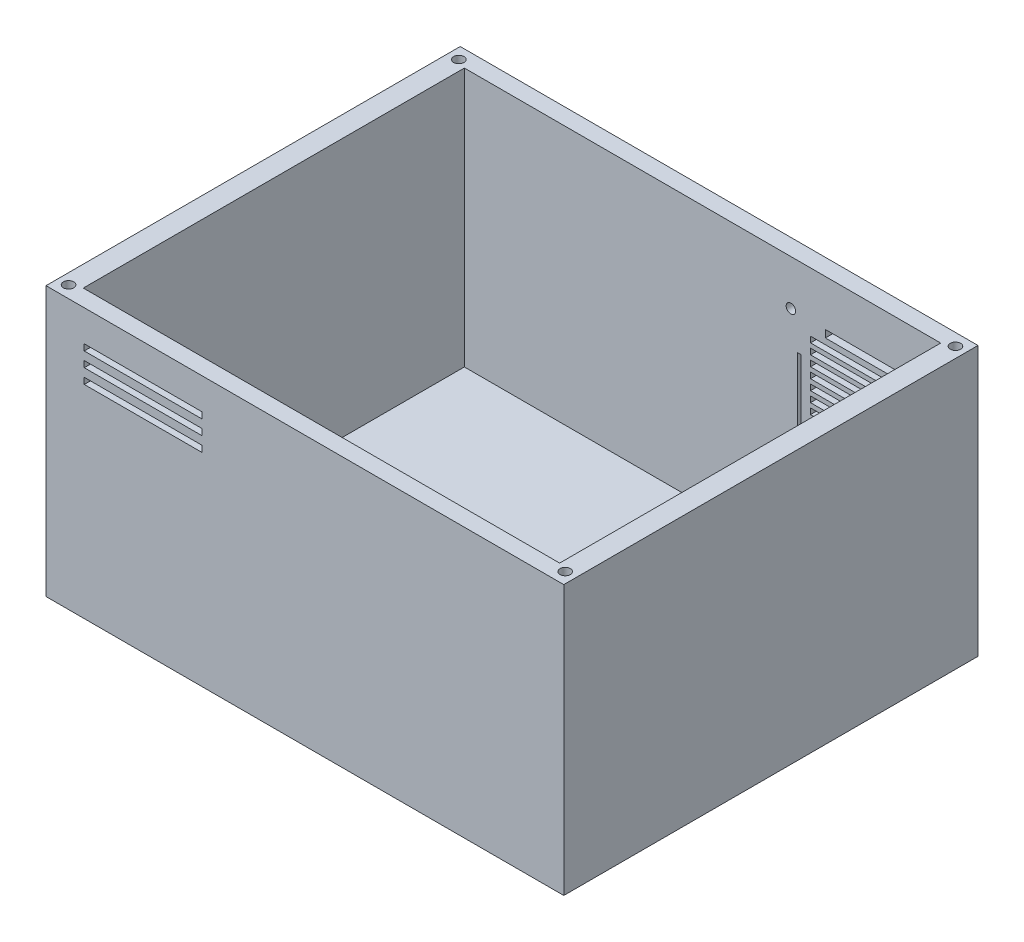
from build123d import *

# Parameters (mm, degrees)
SKETCH1_W           = 250
SKETCH1_H           = 200
SKETCH1_W_2         = 230
SKETCH1_H_2         = 184
BOSS_EXTRUDE1_DEPTH = 125
SKETCH2_W           = 250
SKETCH2_H           = 200
BOSS_EXTRUDE2_DEPTH = 5
SKETCH3_R           = 2.5
CUT_EXTRUDE1_DEPTH  = 5
SKETCH4_W           = 56.888032222
SKETCH4_H           = 3
CUT_EXTRUDE2_DEPTH  = 10
SKETCH5_R           = 2.28
CUT_EXTRUDE3_DEPTH  = 10
SKETCH6_W           = 51.923491606
SKETCH6_H           = 2.813206455
SKETCH6_W_2         = 1.706106107
SKETCH6_H_2         = 39.950466237
SKETCH6_W_3         = 35.31144106
SKETCH6_H_3         = 3.552801372
CUT_EXTRUDE4_DEPTH  = 10


with BuildPart() as part:
    # Sketch1 → Boss-Extrude1 (new body)
    with BuildSketch(Plane(origin=(0, 0, 0), x_dir=(1, 0, 0), z_dir=(0, 1, 0))):
        Rectangle(SKETCH1_W, SKETCH1_H)
        Rectangle(SKETCH1_W_2, SKETCH1_H_2, mode=Mode.SUBTRACT)
    extrude(amount=BOSS_EXTRUDE1_DEPTH)

    # Sketch2 → Boss-Extrude2 (add)
    with BuildSketch(Plane(origin=(0, 0, 0), x_dir=(1, 0, 0), z_dir=(0, 1, 0))):
        Rectangle(SKETCH2_W, SKETCH2_H)
    extrude(amount=-BOSS_EXTRUDE2_DEPTH)

    # Sketch3 → Cut-Extrude1 (cut)
    with BuildSketch(Plane(origin=(0, 125, 0), x_dir=(1, 0, 0), z_dir=(0, 1, 0))):
        with Locations(Location((-119.900696791, -94.21890742, 0), (0, 0, 270))):
            Circle(SKETCH3_R)
        with Locations(Location((-119.900696791, 94.21890742, 0), (0, 0, 90))):
            Circle(SKETCH3_R)
        with Locations(Location((119.900696791, 94.21890742, 0), (0, 0, 270))):
            Circle(SKETCH3_R)
        with Locations(Location((119.900696791, -94.21890742, 0), (0, 0, 90))):
            Circle(SKETCH3_R)
    extrude(amount=-CUT_EXTRUDE1_DEPTH, mode=Mode.SUBTRACT)

    # Sketch4 → Cut-Extrude2 (cut)
    with BuildSketch(Plane.XY.offset(100)):
        with Locations((-78.091753323, 108.422214629)):
            Rectangle(SKETCH4_W, SKETCH4_H)
        with Locations((-78.091753323, 101.422214629)):
            Rectangle(SKETCH4_W, SKETCH4_H)
        with Locations((-78.091753323, 94.422214629)):
            Rectangle(SKETCH4_W, SKETCH4_H)
    extrude(amount=-CUT_EXTRUDE2_DEPTH, mode=Mode.SUBTRACT)

    # Sketch5 → Cut-Extrude3 (cut)
    with BuildSketch(Plane(origin=(0, 0, -100), x_dir=(-1, 0, 0), z_dir=(0, 0, -1))):
        with Locations((-42.656938609, 32.257458939)):
            Circle(SKETCH5_R)
        with Locations((-113.658122402, 103.257458939)):
            Circle(SKETCH5_R)
        with Locations(Location((-42.656938609, 103.257458939, 0), (0, 0, 180))):
            Circle(SKETCH5_R)
        with Locations(Location((-113.658122402, 32.257458939, 0), (0, 0, 126.053669341))):
            Circle(SKETCH5_R)
    extrude(amount=-CUT_EXTRUDE3_DEPTH, mode=Mode.SUBTRACT)

    # Sketch6 → Cut-Extrude4 (cut)
    with BuildSketch(Plane(origin=(0, 0, -100), x_dir=(-1, 0, 0), z_dir=(0, 0, -1))):
        with Locations((-78.080252777, 90.048098673)):
            Rectangle(SKETCH6_W, SKETCH6_H)
        with Locations((-78.080252777, 95.048098673)):
            Rectangle(SKETCH6_W, SKETCH6_H)
        with Locations((-78.080252777, 85.048098673)):
            Rectangle(SKETCH6_W, SKETCH6_H)
        with Locations((-78.080252777, 80.048098673)):
            Rectangle(SKETCH6_W, SKETCH6_H)
        with Locations((-78.080252777, 75.048098673)):
            Rectangle(SKETCH6_W, SKETCH6_H)
        with Locations((-78.080252777, 70.048098673)):
            Rectangle(SKETCH6_W, SKETCH6_H)
        with Locations((-78.080252777, 65.048098673)):
            Rectangle(SKETCH6_W, SKETCH6_H)
        with Locations((-78.080252777, 60.048098673)):
            Rectangle(SKETCH6_W, SKETCH6_H)
        with Locations((-78.080252777, 55.048098673)):
            Rectangle(SKETCH6_W, SKETCH6_H)
        with Locations((-78.080252777, 50.048098673)):
            Rectangle(SKETCH6_W, SKETCH6_H)
        with Locations((-78.080252777, 45.048098673)):
            Rectangle(SKETCH6_W, SKETCH6_H)
        with Locations((-78.080252777, 40.048098673)):
            Rectangle(SKETCH6_W, SKETCH6_H)
        with Locations((-109.706066926, 66.479468782)):
            Rectangle(SKETCH6_W_2, SKETCH6_H_2)
        with Locations((-46.608994087, 66.479468782)):
            Rectangle(SKETCH6_W_2, SKETCH6_H_2)
        with Locations((-76.965618839, 101.05962005)):
            Rectangle(SKETCH6_W_3, SKETCH6_H_3)
        with Locations((-76.965618839, 34.455297829)):
            Rectangle(SKETCH6_W_3, SKETCH6_H_3)
    extrude(amount=-CUT_EXTRUDE4_DEPTH, mode=Mode.SUBTRACT)


solid = part.part
